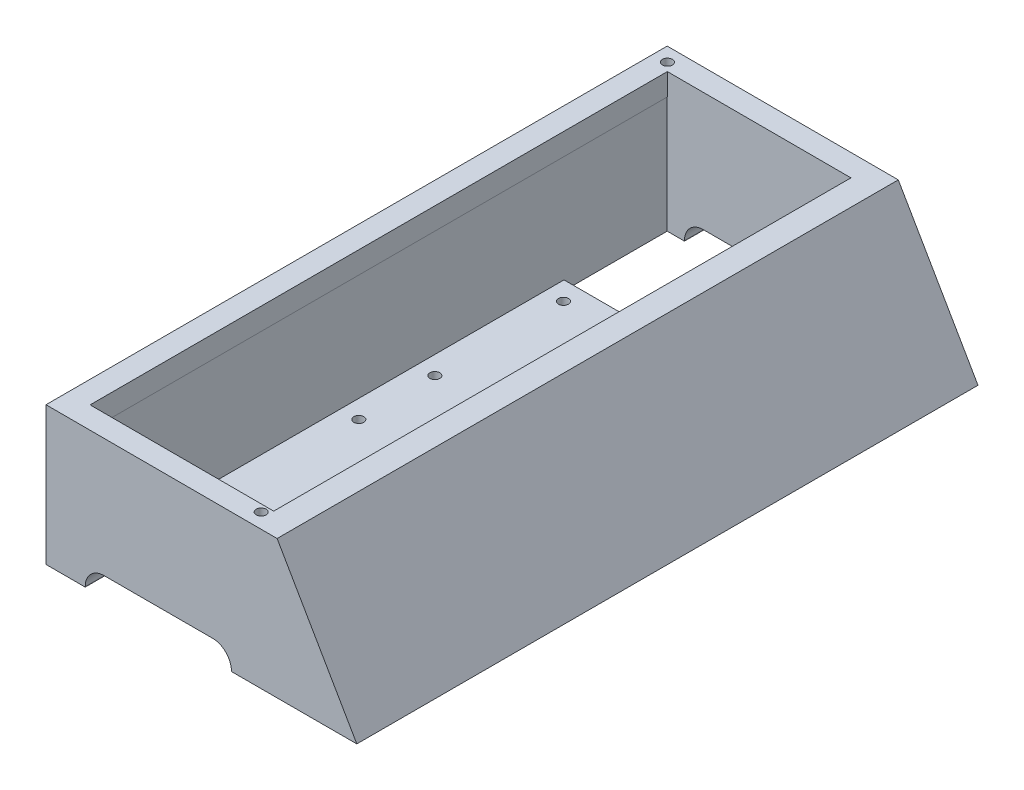
from build123d import *

# Parameters (mm, degrees)
BOSS_EXTRUDE1_DEPTH = 198
SHELL1_T            = -7
SKETCH2_W           = 184
SKETCH2_H           = 91.833810452
CUT_EXTRUDE1_DEPTH  = 10
SKETCH3_W           = 51.015734787
SKETCH3_H           = 184
CUT_EXTRUDE3_DEPTH  = 10
SKETCH4_W           = 43.227096231
SKETCH4_H           = 118.22
SKETCH4_W_2         = 10
SKETCH4_H_2         = 10
BOSS_EXTRUDE2_DEPTH = 3
SKETCH6_R           = 1.585
CUT_EXTRUDE5_DEPTH  = 10
SKETCH10_R          = 1.585
CUT_EXTRUDE8_DEPTH  = 5
SKETCH9_W           = 46.592666587
SKETCH9_H           = 6.179476357
CUT_EXTRUDE7_DEPTH  = 10
FILLET1_R           = 6
FILLET2_R           = 6
SKETCH11_R          = 1.585
CUT_EXTRUDE9_DEPTH  = 5
SKETCH12_R          = 1.585
CUT_EXTRUDE10_DEPTH = 5


with BuildPart() as part:
    # Sketch1 → Boss-Extrude1 (new body)
    with BuildSketch(Plane.XY):
        Polygon((0, 0), (99.07, 0), (73.665, 44.002750766), (0, 44.1), align=None)
    extrude(amount=BOSS_EXTRUDE1_DEPTH)

    # Shell1
    shell1_openings = [part.faces().sort_by_distance(p)[0] for p in [
        (49.535, 0, 99),
    ]]
    offset(amount=SHELL1_T, openings=shell1_openings, kind=Kind.INTERSECTION)

    # Sketch2 → Cut-Extrude1 (cut)
    with BuildSketch(Plane(origin=(68.240322174, 39.398568376, 0), x_dir=(0, 0, 1), z_dir=(-0.866025403784436, -0.5000000000000048, 0))):
        with Locations((99, 0.42335711)):
            Rectangle(SKETCH2_W, SKETCH2_H)
    extrude(amount=CUT_EXTRUDE1_DEPTH, mode=Mode.SUBTRACT)

    # Sketch3 → Cut-Extrude3 (cut)
    with BuildSketch(Plane(origin=(0.058218743, 44.099923142, 0), x_dir=(0.9999991285962467, -0.001320154061894519, 0), z_dir=(0.001320154061894519, 0.9999991285962467, 0))):
        with Locations((32.507861294, -99)):
            Rectangle(SKETCH3_W, SKETCH3_H)
    extrude(amount=-CUT_EXTRUDE3_DEPTH, mode=Mode.SUBTRACT)

    # Sketch4 → Boss-Extrude2 (add)
    with BuildSketch(Plane.XZ):
        with Locations((28.613548116, 99)):
            Rectangle(SKETCH4_W, SKETCH4_H)
        with Locations((85.987096231, 86)):
            Rectangle(SKETCH4_W_2, SKETCH4_H_2)
    boss_extrude2 = extrude(amount=-BOSS_EXTRUDE2_DEPTH)

    # Sketch6 → Cut-Extrude5 (cut)
    with BuildSketch(Plane(origin=(0, 3, 0), x_dir=(1, 0, 0), z_dir=(0, 1, 0))):
        with Locations(Location((12.830469551, -45.887182752, 0), (0, 0, 270))):
            Circle(SKETCH6_R)
        with Locations(Location((12.830469551, -86.887182752, 0), (0, 0, 270))):
            Circle(SKETCH6_R)
        with Locations(Location((12.830469551, -111.112817248, 0), (0, 0, 270))):
            Circle(SKETCH6_R)
        with Locations(Location((12.830469551, -152.112817248, 0), (0, 0, 270))):
            Circle(SKETCH6_R)
    extrude(amount=-CUT_EXTRUDE5_DEPTH, mode=Mode.SUBTRACT)

    # Sketch10 → Cut-Extrude8 (cut)
    with BuildSketch(Plane.XZ):
        with Locations(Location((84.092666587, 85.739056505, 0), (0, 0, 270))):
            Circle(SKETCH10_R)
    cut_extrude8 = extrude(amount=-CUT_EXTRUDE8_DEPTH, mode=Mode.SUBTRACT)

    # Sketch9 → Cut-Extrude7 (cut)
    with BuildSketch(Plane.XY.offset(198)):
        with Locations((35.796333293, 3.089738179)):
            Rectangle(SKETCH9_W, SKETCH9_H)
    cut_extrude7 = extrude(amount=-CUT_EXTRUDE7_DEPTH, mode=Mode.SUBTRACT)

    # Mirror1: Cut-Extrude7 across plane
    add(cut_extrude7.mirror(Plane(origin=(0, 0, 99), x_dir=(1, 0, 0), z_dir=(0, 0, -1))), mode=Mode.SUBTRACT)

    # Fillet1
    fillet1_edges = [part.edges().sort_by_distance(p)[0] for p in [
        (12.5, 6.179476357, 3.5),
        (59.092666587, 6.179476357, 3.5),
    ]]
    fillet(fillet1_edges, radius=FILLET1_R)

    # Fillet2
    fillet2_edges = [part.edges().sort_by_distance(p)[0] for p in [
        (12.5, 6.179476357, 194.5),
        (59.092666587, 6.179476357, 194.5),
    ]]
    fillet(fillet2_edges, radius=FILLET2_R)

    # Mirror2: Boss-Extrude2, Cut-Extrude8 across plane
    add(boss_extrude2.mirror(Plane(origin=(0, 0, 99), x_dir=(1, 0, 0), z_dir=(0, 0, -1))))
    add(cut_extrude8.mirror(Plane(origin=(0, 0, 99), x_dir=(1, 0, 0), z_dir=(0, 0, -1))), mode=Mode.SUBTRACT)

    # Sketch11 → Cut-Extrude9 (cut)
    with BuildSketch(Plane.XZ):
        with Locations(Location((12.830469551, 152.112817248, 0), (0, 0, 270))):
            Circle(SKETCH11_R)
        with Locations(Location((12.830469551, 111.112817248, 0), (0, 0, 270))):
            Circle(SKETCH11_R)
        with Locations(Location((12.830469551, 86.887182752, 0), (0, 0, 270))):
            Circle(SKETCH11_R)
        with Locations(Location((12.830469551, 45.887182752, 0), (0, 0, 270))):
            Circle(SKETCH11_R)
    extrude(amount=-CUT_EXTRUDE9_DEPTH, mode=Mode.SUBTRACT)

    # Sketch12 → Cut-Extrude10 (cut)
    with BuildSketch(Plane(origin=(0.058218743, 44.099923142, 0), x_dir=(0.9999991285962467, -0.001320154061894519, 0), z_dir=(0.001320154061894519, 0.9999991285962467, 0))):
        with Locations(Location((63.768297777, -193.245706001, 0), (0, 0, 180))):
            Circle(SKETCH12_R)
        with Locations(Location((4.416986766, -4.402159503, 0), (0, 0, 180))):
            Circle(SKETCH12_R)
    extrude(amount=-CUT_EXTRUDE10_DEPTH, mode=Mode.SUBTRACT)


solid = part.part
